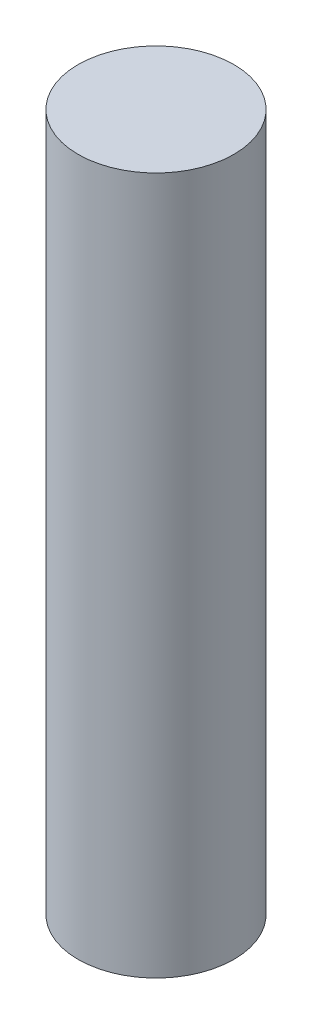
from build123d import *

# Parameters (mm, degrees)
SKETCH1_R           = 3.35
BOSS_EXTRUDE1_DEPTH = 30


with BuildPart() as part:
    # Sketch1 → Boss-Extrude1 (new body)
    with BuildSketch(Plane(origin=(0, 0, 0), x_dir=(1, 0, 0), z_dir=(0, 1, 0))):
        with Locations(Location((0, 0, 0), (0, 0, 270))):
            Circle(SKETCH1_R)
    extrude(amount=BOSS_EXTRUDE1_DEPTH)


solid = part.part
